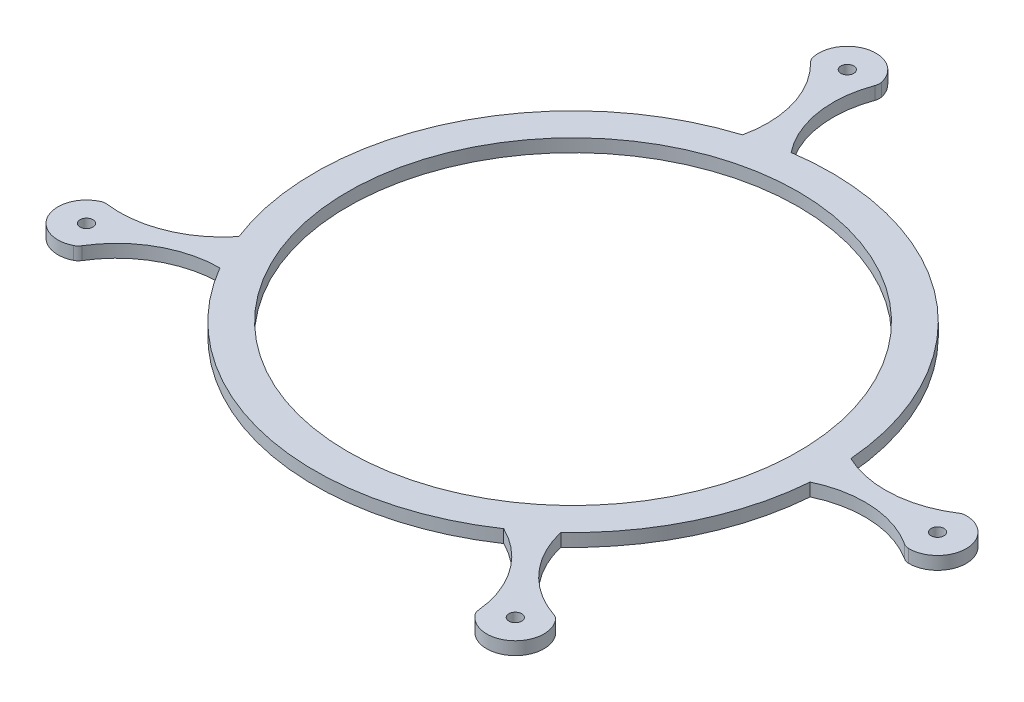
from build123d import *

# Parameters (mm, degrees)
SKETCH35_R          = 1.5875
SKETCH35_R_2        = 55.372
BOSS_EXTRUDE5_DEPTH = 3.175


with BuildPart() as part:
    # Sketch35 → Boss-Extrude5 (new body)
    with BuildSketch(Plane(origin=(0, 0, 0), x_dir=(1, 0, 0), z_dir=(0, 1, 0))):
        with BuildLine():
            ThreePointArc((72.63160158, -196.735304264), (79.763343901, -189.694281524), (72.63160158, -182.653258784))
            ThreePointArc((72.63160158, -182.653258784), (71.923524594, -182.763416409), (71.274394231, -183.066957991))
            ThreePointArc((71.274394231, -183.066957991), (62.061766366, -186.749902585), (52.140854077, -186.639937081))
            ThreePointArc((52.140854077, -186.639937081), (49.212807322, -185.841233605), (46.400330688, -184.700461837))
            ThreePointArc((46.400330688, -184.700461837), (40.308522411, -162.14266409), (26.470306292, -143.315339746))
            ThreePointArc((26.470306292, -143.315339746), (2.051929923, -129.089326239), (-26.120702924, -126.866867398))
            ThreePointArc((-26.120702924, -126.866867398), (-27.858708089, -124.378751024), (-29.2889381, -121.701844758))
            ThreePointArc((-29.2889381, -121.701844758), (-31.603757208, -112.05414008), (-30.063154281, -102.252959759))
            ThreePointArc((-30.063154281, -102.252959759), (-29.911668214, -101.552560093), (-29.961834423, -100.837723697))
            ThreePointArc((-29.961834423, -100.837723697), (-38.413285984, -95.451564003), (-43.690813622, -103.971273609))
            ThreePointArc((-43.690813622, -103.971273609), (-43.425855926, -104.63708525), (-42.98547967, -105.202396203))
            ThreePointArc((-42.98547967, -105.202396203), (-37.34487163, -113.364511982), (-35.244469401, -123.061155914))
            ThreePointArc((-35.244469401, -123.061155914), (-35.371596014, -126.093518667), (-35.857931325, -129.089326239))
            ThreePointArc((-35.857931325, -129.089326239), (-74.114523813, -162.14266409), (-76.104068675, -212.661291576))
            ThreePointArc((-76.104068675, -212.661291576), (-78.143060244, -214.909379303), (-80.434594764, -216.899418143))
            ThreePointArc((-80.434594764, -216.899418143), (-89.325315633, -221.303016159), (-99.223576302, -221.982007162))
            ThreePointArc((-99.223576302, -221.982007162), (-99.940124308, -221.990172755), (-100.625875231, -222.198147255))
            ThreePointArc((-100.625875231, -222.198147255), (-103.996367762, -231.636236566), (-94.515904683, -234.885631829))
            ThreePointArc((-94.515904683, -234.885631829), (-93.925744965, -234.479160148), (-93.472600473, -233.924031523))
            ThreePointArc((-93.472600473, -233.924031523), (-86.770279347, -226.608603676), (-77.784133989, -222.403156653))
            ThreePointArc((-77.784133989, -222.403156653), (-74.799510568, -221.852331744), (-71.770594359, -221.659843715))
            ThreePointArc((-71.770594359, -221.659843715), (-52.467656797, -242.300414596), (-26.120702924, -252.52169565))
            ThreePointArc((-26.120702924, -252.52169565), (-2.772921395, -251.602203947), (18.661655395, -242.300414596))
            ThreePointArc((18.661655395, -242.300414596), (21.307097177, -243.788037808), (23.75715599, -245.579293472))
            ThreePointArc((23.75715599, -245.579293472), (30.028718121, -253.267212663), (32.893255611, -262.766213559))
            ThreePointArc((32.893255611, -262.766213559), (33.060663407, -263.462979195), (33.416017488, -264.085258231))
            ThreePointArc((33.416017488, -264.085258231), (43.367479341, -265.271073029), (44.425803982, -255.305246485))
            ThreePointArc((44.425803982, -255.305246485), (43.898200503, -254.82033176), (43.256155975, -254.502076287))
            ThreePointArc((43.256155975, -254.502076287), (34.632734421, -249.595632182), (28.533121278, -241.770588249))
            ThreePointArc((28.533121278, -241.770588249), (27.331965509, -238.983365642), (26.470306292, -236.073223302))
            ThreePointArc((26.470306292, -236.073223302), (40.308522411, -217.245898958), (46.400330688, -194.68810121))
            ThreePointArc((46.400330688, -194.68810121), (49.212807322, -193.547329442), (52.140854077, -192.748625967))
            ThreePointArc((52.140854077, -192.748625967), (62.061766366, -192.638660462), (71.274394231, -196.321605056))
            ThreePointArc((71.274394231, -196.321605056), (71.923524594, -196.625146639), (72.63160158, -196.735304264))
        make_face()
        with Locations(Location((72.72174416, -189.694281524, 0), (0, 0, 270))):
            Circle(SKETCH35_R, mode=Mode.SUBTRACT)
        with Locations(Location((-16.903000701, -189.694281524, 0), (0, 0, 270))):
            Circle(SKETCH35_R_2, mode=Mode.SUBTRACT)
        with Locations(Location((-97.652105615, -228.581000942, 0), (0, 0, 270))):
            Circle(SKETCH35_R, mode=Mode.SUBTRACT)
        with Locations(Location((-36.846382633, -102.316616136, 0), (0, 0, 270))):
            Circle(SKETCH35_R, mode=Mode.SUBTRACT)
        with Locations(Location((38.977113714, -259.765728664, 0), (0, 0, 270))):
            Circle(SKETCH35_R, mode=Mode.SUBTRACT)
    extrude(amount=BOSS_EXTRUDE5_DEPTH)


solid = part.part
